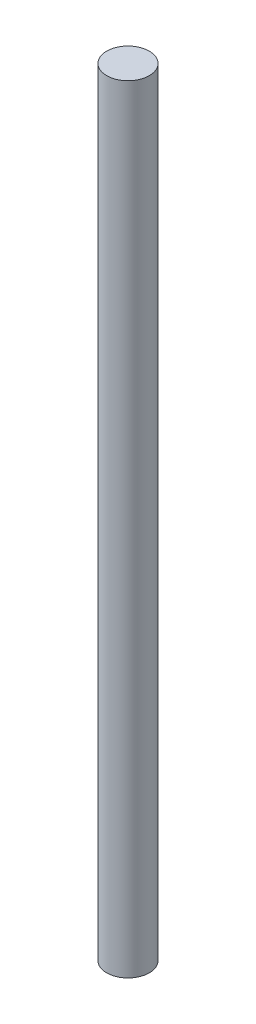
from build123d import *

# Parameters (mm, degrees)
SKETCH1_R           = 2
BOSS_EXTRUDE1_DEPTH = 73


with BuildPart() as part:
    # Sketch1 → Boss-Extrude1 (new body)
    with BuildSketch(Plane(origin=(0, 0, 0), x_dir=(1, 0, 0), z_dir=(0, 1, 0))):
        with Locations(Location((0, 0, 0), (0, 0, 270))):
            Circle(SKETCH1_R)
    extrude(amount=BOSS_EXTRUDE1_DEPTH)


solid = part.part
